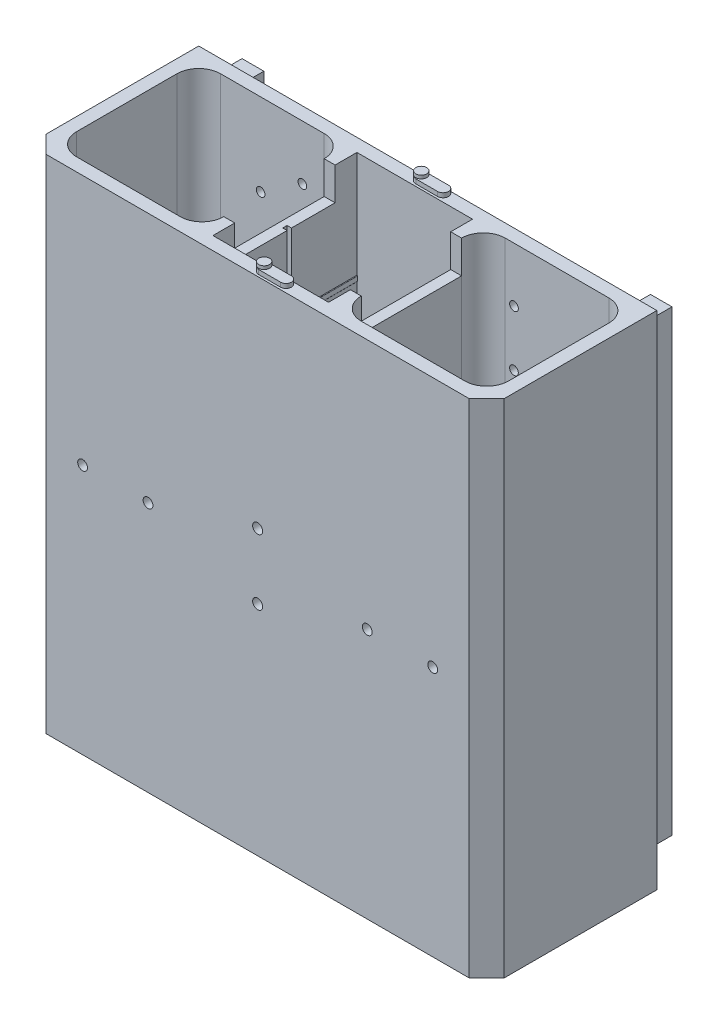
from build123d import *

# Parameters (mm, degrees)
SKETCH_1_W           = 210
SKETCH_1_H           = 230
EXTRUDE_1_DEPTH      = 6
SKETCH_2_W           = 9.85
SKETCH_2_H           = 209.85
SKETCH_2_W_2         = 10
EXTRUDE_3_DEPTH      = 15
SKETCH_3_R           = 2
CUT_EXTRUDE_1_DEPTH  = 10
SKETCH_17_W          = 6
SKETCH_17_H          = 230
EXTRUDE_9_DEPTH      = 66
EXTRUDE_10_DEPTH     = 6
CHAMFER_3_SIZE       = 8
SKETCH_19_W          = 5
SKETCH_19_H          = 230
EXTRUDE_11_DEPTH     = 66
FILLET_4_R           = 10
SKETCH_21_R          = 2.3
CUT_EXTRUDE_9_DEPTH  = 6
EXTRUDE_13_DEPTH     = 66
SKETCH_28_W          = 53
SKETCH_28_H          = 3
EXTRUDE_14_DEPTH     = 66
SKETCH_30_W          = 2
SKETCH_30_H          = 2
CUT_EXTRUDE_10_DEPTH = 35
SKETCH_31_R          = 1.35
SKETCH_31_W          = 14
SKETCH_31_H          = 14
CUT_EXTRUDE_11_DEPTH = 316.06185361
SKETCH_32_W          = 12
SKETCH_32_H          = 10
CUT_EXTRUDE_12_DEPTH = 320.662321834
CUT_EXTRUDE_13_REACH = 278.182
SKETCH_33_W          = 20
SKETCH_33_H          = 8.46
SKETCH_34_R          = 2.25
CUT_EXTRUDE_14_DEPTH = 30
SKETCH_36_R          = 2.25
CUT_EXTRUDE_15_DEPTH = 30
SKETCH_39_W          = 46
SKETCH_39_H          = 15
CUT_EXTRUDE_16_DEPTH = 104
SKETCH_40_R          = 1.5
EXTRUDE_16_DEPTH     = 3
SKETCH_41_R          = 2.5
EXTRUDE_17_DEPTH     = 1.5
SKETCH_44_R          = 1.62
EXTRUDE_19_DEPTH     = 2
SKETCH_46_R          = 1.62
EXTRUDE_20_DEPTH     = 2


with BuildPart() as part:
    # 草图1 → 凸台-拉伸1 (new body)
    with BuildSketch(Plane.XY):
        with Locations((105, 115)):
            Rectangle(SKETCH_1_W, SKETCH_1_H)
    extrude(amount=EXTRUDE_1_DEPTH)

    # 草图2 → 凸台-拉伸3 (add)
    with BuildSketch(Plane(origin=(0, 0, 0), x_dir=(-1, 0, 0), z_dir=(0, 0, -1))):
        with Locations((-197, 115)):
            Rectangle(SKETCH_2_W, SKETCH_2_H)
        with Locations((-9.85, 115)):
            Rectangle(SKETCH_2_W_2, SKETCH_2_H)
    extrude(amount=EXTRUDE_3_DEPTH)

    # 草图3 → 切除-拉伸1 (cut)
    with BuildSketch(Plane(origin=(0, 0, 0), x_dir=(-1, 0, 0), z_dir=(0, 0, -1))):
        with Locations((-169.6425573, 192.25)):
            Circle(SKETCH_3_R)
        with Locations((-150.5, 205)):
            Circle(SKETCH_3_R)
        with Locations((-150.5, 179.5)):
            Circle(SKETCH_3_R)
        with Locations(Location((-150.5, 50.5, 0), (0, 0, 180))):
            Circle(SKETCH_3_R)
        with Locations(Location((-150.5, 25, 0), (0, 0, 180))):
            Circle(SKETCH_3_R)
        with Locations(Location((-169.6425573, 37.75, 0), (0, 0, 180))):
            Circle(SKETCH_3_R)
        with Locations((-34.3574427, 192.25)):
            Circle(SKETCH_3_R)
        with Locations((-53.5, 205)):
            Circle(SKETCH_3_R)
        with Locations((-53.5, 179.5)):
            Circle(SKETCH_3_R)
        with Locations(Location((-53.5, 50.5, 0), (0, 0, 180))):
            Circle(SKETCH_3_R)
        with Locations(Location((-53.5, 25, 0), (0, 0, 180))):
            Circle(SKETCH_3_R)
        with Locations(Location((-34.3574427, 37.75, 0), (0, 0, 180))):
            Circle(SKETCH_3_R)
    extrude(amount=-CUT_EXTRUDE_1_DEPTH, mode=Mode.SUBTRACT)

    # 草图17 → 凸台-拉伸9 (add)
    with BuildSketch(Plane.XY.offset(6)):
        with Locations((3, 115)):
            Rectangle(SKETCH_17_W, SKETCH_17_H)
        with Locations((207, 115)):
            Rectangle(SKETCH_17_W, SKETCH_17_H)
    extrude(amount=EXTRUDE_9_DEPTH)

    # 草图18 → 凸台-拉伸10 (add)
    with BuildSketch(Plane.XY.offset(72)):
        Polygon((210, 230), (204, 230), (6, 230), (0, 230), (0, 0), (6, 0), (204, 0), (210, 0), align=None)
    extrude(amount=EXTRUDE_10_DEPTH)

    # 倒角3
    chamfer_3_edges = [part.edges().sort_by_distance(p)[0] for p in [
        (210, 115, 78),
        (0, 115, 78),
    ]]
    chamfer(chamfer_3_edges, length=CHAMFER_3_SIZE)

    # 草图19 → 凸台-拉伸11 (add)
    with BuildSketch(Plane(origin=(0, 0, 72), x_dir=(-1, 0, 0), z_dir=(0, 0, -1))):
        with Locations((-134, 115)):
            Rectangle(SKETCH_19_W, SKETCH_19_H)
        with Locations((-76, 115)):
            Rectangle(SKETCH_19_W, SKETCH_19_H)
    extrude(amount=EXTRUDE_11_DEPTH)

    # 圆角4
    fillet_4_edges = [part.edges().sort_by_distance(p)[0] for p in [
        (6, 115, 6),
        (6, 115, 72),
        (204, 115, 6),
        (204, 115, 72),
        (73.5, 115, 6),
        (73.5, 115, 72),
        (136.5, 115, 72),
        (136.5, 115, 6),
    ]]
    fillet(fillet_4_edges, radius=FILLET_4_R)

    # 草图21 → 切除-拉伸9 (cut)
    with BuildSketch(Plane.XY.offset(72)):
        with Locations((105, 130)):
            Circle(SKETCH_21_R)
        with Locations((105, 100)):
            Circle(SKETCH_21_R)
    extrude(amount=CUT_EXTRUDE_9_DEPTH, mode=Mode.SUBTRACT)

    # 草图26 → 凸台-拉伸13 (add)
    with BuildSketch(Plane(origin=(0, 0, 72), x_dir=(-1, 0, 0), z_dir=(0, 0, -1))):
        with BuildLine():
            Line((-131.26, 181), (-131.26, 179))
            ThreePointArc((-131.26, 179), (-131.5, 178.76), (-131.74, 179))
            Line((-131.74, 179), (-131.74, 181))
            ThreePointArc((-131.74, 181), (-131.5, 181.24), (-131.26, 181))
        make_face()
        with BuildLine():
            Line((-131.26, 22.5), (-131.26, 20.5))
            ThreePointArc((-131.26, 20.5), (-131.5, 20.26), (-131.74, 20.5))
            Line((-131.74, 20.5), (-131.74, 22.5))
            ThreePointArc((-131.74, 22.5), (-131.5, 22.74), (-131.26, 22.5))
        make_face()
    extrude_13 = extrude(amount=EXTRUDE_13_DEPTH)

    # 镜向2: 凸台-拉伸13 across plane
    add(extrude_13.mirror(Plane.ZY.offset(-105)))

    # 草图28 → 凸台-拉伸14 (add)
    with BuildSketch(Plane(origin=(0, 0, 72), x_dir=(-1, 0, 0), z_dir=(0, 0, -1))):
        with Locations((-105, 9.96)):
            Rectangle(SKETCH_28_W, SKETCH_28_H)
    extrude(amount=EXTRUDE_14_DEPTH)

    # 草图30 → 切除-拉伸10 (cut)
    with BuildSketch(Plane(origin=(0, 230, 0), x_dir=(1, 0, 0), z_dir=(0, 1, 0))):
        with Locations((77.5, -37)):
            Rectangle(SKETCH_30_W, SKETCH_30_H)
    extrude(amount=-CUT_EXTRUDE_10_DEPTH, mode=Mode.SUBTRACT)

    # 草图31 → 切除-拉伸11 (cut, through all)
    with BuildSketch(Plane.XZ.offset(-8.46)):
        with Locations((92.7, 16.2)):
            Circle(SKETCH_31_R)
        with Locations((117.3, 16.2)):
            Circle(SKETCH_31_R)
        with Locations((105, 16.2)):
            Rectangle(SKETCH_31_W, SKETCH_31_H)
    extrude(amount=-CUT_EXTRUDE_11_DEPTH, mode=Mode.SUBTRACT)

    # 草图32 → 切除-拉伸12 (cut, through all)
    with BuildSketch(Plane.XY.offset(6)):
        with Locations((125.5, 3.46)):
            Rectangle(SKETCH_32_W, SKETCH_32_H)
    extrude(amount=-CUT_EXTRUDE_12_DEPTH, mode=Mode.SUBTRACT)

    # 草图33 → 切除-拉伸13 (cut, up to next)
    with BuildSketch(Plane.ZY.offset(-131.5), mode=Mode.PRIVATE) as cut_extrude_13_sk1:
        with Locations((40, 4.23)):
            Rectangle(SKETCH_33_W, SKETCH_33_H)
    cut_extrude_13_tool1 = extrude(cut_extrude_13_sk1.sketch, amount=-CUT_EXTRUDE_13_REACH, mode=Mode.PRIVATE) & part.part
    add(cut_extrude_13_tool1.solids().sort_by_distance((131.5, 4.23, 40))[0], mode=Mode.SUBTRACT)

    # 草图34 → 切除-拉伸14 (cut)
    with BuildSketch(Plane(origin=(0, 0, 72), x_dir=(-1, 0, 0), z_dir=(0, 0, -1))):
        with Locations((-185.25, 115)):
            Circle(SKETCH_34_R)
        with Locations((-155.25, 115)):
            Circle(SKETCH_34_R)
    extrude(amount=-CUT_EXTRUDE_14_DEPTH, mode=Mode.SUBTRACT)

    # 草图36 → 切除-拉伸15 (cut)
    with BuildSketch(Plane(origin=(0, 0, 72), x_dir=(-1, 0, 0), z_dir=(0, 0, -1))):
        with Locations((-54.75, 115)):
            Circle(SKETCH_36_R)
        with Locations((-24.75, 115)):
            Circle(SKETCH_36_R)
    extrude(amount=-CUT_EXTRUDE_15_DEPTH, mode=Mode.SUBTRACT)

    # 草图39 → 切除-拉伸16 (cut)
    with BuildSketch(Plane.ZY.offset(-73.5)):
        with Locations((39, 222.5)):
            Rectangle(SKETCH_39_W, SKETCH_39_H)
    extrude(amount=-CUT_EXTRUDE_16_DEPTH, mode=Mode.SUBTRACT)

    # 草图40 → 凸台-拉伸16 (add)
    with BuildSketch(Plane(origin=(0, 230, 0), x_dir=(1, 0, 0), z_dir=(0, 1, 0))):
        with Locations(Location((105, -3, 0), (0, 0, 270))):
            Circle(SKETCH_40_R)
    extrude_16 = extrude(amount=EXTRUDE_16_DEPTH)

    # 草图41 → 凸台-拉伸17 (add)
    with BuildSketch(Plane(origin=(0, 233, 0), x_dir=(1, 0, 0), z_dir=(0, 1, 0))):
        with Locations(Location((105, -3, 0), (0, 0, 270))):
            Circle(SKETCH_41_R)
    extrude_17 = extrude(amount=EXTRUDE_17_DEPTH)

    # 镜向3: 凸台-拉伸16, 凸台-拉伸17 across plane
    add(extrude_16.mirror(Plane.XY.offset(39)))
    add(extrude_17.mirror(Plane.XY.offset(39)))


with BuildPart() as body_2:
    # 草图44 → 凸台-拉伸19 (new body)
    with BuildSketch(Plane(origin=(0, 230.5, 0), x_dir=(1, 0, 0), z_dir=(0, 1, 0))):
        with BuildLine():
            Line((105, -0.5), (115, -0.5))
            ThreePointArc((115, -0.5), (117.5, -3), (115, -5.5))
            Line((115, -5.5), (105, -5.5))
            ThreePointArc((105, -5.5), (102.5, -3), (105, -0.5))
        make_face()
        with Locations(Location((105, -3, 0), (0, 0, 270))):
            Circle(SKETCH_44_R, mode=Mode.SUBTRACT)
    extrude(amount=EXTRUDE_19_DEPTH)


with BuildPart() as body_3:
    # 草图46 → 凸台-拉伸20 (new body)
    with BuildSketch(Plane(origin=(0, 230.5, 0), x_dir=(1, 0, 0), z_dir=(0, 1, 0))):
        with BuildLine():
            Line((115, -72.5), (105, -72.5))
            ThreePointArc((105, -72.5), (102.5, -75), (105, -77.5))
            Line((105, -77.5), (115, -77.5))
            ThreePointArc((115, -77.5), (117.5, -75), (115, -72.5))
        make_face()
        with Locations(Location((105, -75, 0), (0, 0, 270))):
            Circle(SKETCH_46_R, mode=Mode.SUBTRACT)
    extrude(amount=EXTRUDE_20_DEPTH)


solid = Compound([part.part, body_2.part, body_3.part])
